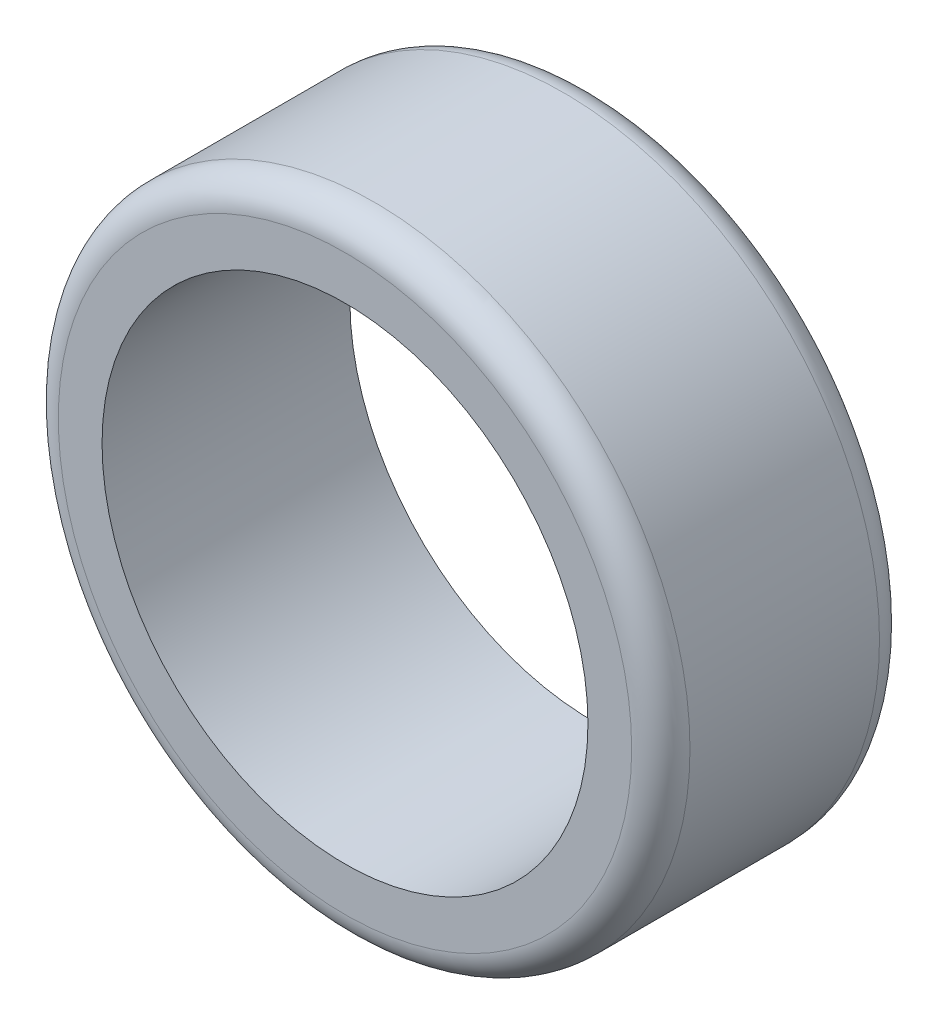
from build123d import *

# Parameters (mm, degrees)
SKETCH_1_R               = 32.5
EXTRUDE_1_DEPTH          = 25.5
CUT_EXTRUDE_1_DEPTH      = 53.561868308
CUT_EXTRUDE_1_DEPTH_BACK = 53.561868308
SKETCH_2_R               = 25
FILLET_1_R               = 3
FILLET_2_R               = 3


with BuildPart() as part:
    # 草图1 → 凸台-拉伸1 (new body)
    with BuildSketch(Plane.XY):
        Circle(SKETCH_1_R)
    extrude(amount=EXTRUDE_1_DEPTH)

    # 草图2 → 切除-拉伸1 (cut, two sides: drawn at the far end of the back side and taken through both)
    with BuildSketch(Plane.XY.offset(25.5).offset(-CUT_EXTRUDE_1_DEPTH_BACK)):
        Circle(SKETCH_2_R)
    extrude(amount=CUT_EXTRUDE_1_DEPTH + CUT_EXTRUDE_1_DEPTH_BACK, mode=Mode.SUBTRACT)

    # 圆角1
    fillet_1_edges = [part.edges().sort_by_distance(p)[0] for p in [
        (-32.5, 0, 25.5),
    ]]
    fillet(fillet_1_edges, radius=FILLET_1_R)

    # 圆角2
    fillet_2_edges = [part.edges().sort_by_distance(p)[0] for p in [
        (-32.5, 0, 0),
    ]]
    fillet(fillet_2_edges, radius=FILLET_2_R)


solid = part.part
